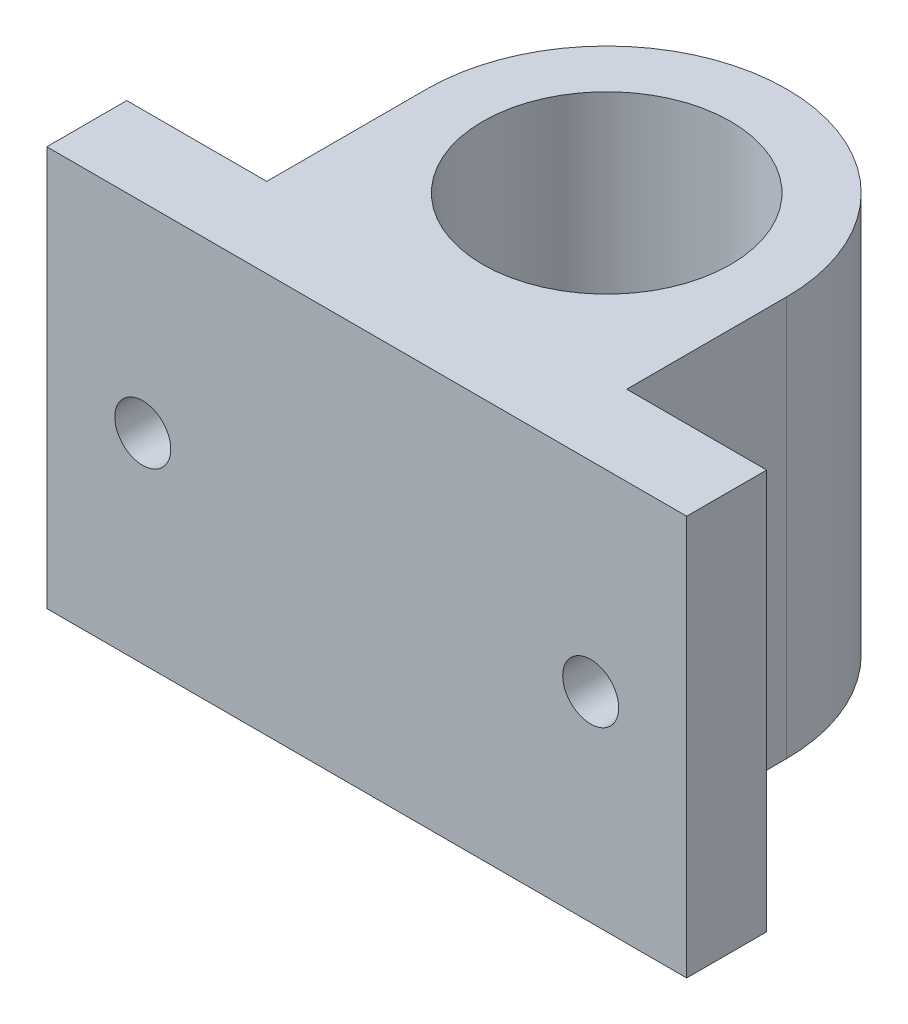
from build123d import *

# Parameters (mm, degrees)
SKETCH_1_R          = 7.75
EXTRUDE_1_DEPTH     = 25
SKETCH_2_R          = 1.75
CUT_EXTRUDE_1_DEPTH = 53.781587215


with BuildPart() as part:
    # 草图1 → 凸台-拉伸1 (new body)
    with BuildSketch(Plane(origin=(0, 0, 0), x_dir=(1, 0, 0), z_dir=(0, 1, 0))):
        with BuildLine():
            Line((1.344086022, 1.112903226), (10.094086022, 1.112903226))
            Line((10.094086022, 1.112903226), (10.094086022, 11.112903226))
            ThreePointArc((10.094086022, 11.112903226), (21.344086022, 22.362903226), (32.594086022, 11.112903226))
            Line((32.594086022, 11.112903226), (32.594086022, 1.112903226))
            Line((32.594086022, 1.112903226), (41.344086022, 1.112903226))
            Line((41.344086022, 1.112903226), (41.344086022, -3.887096774))
            Line((41.344086022, -3.887096774), (1.344086022, -3.887096774))
            Line((1.344086022, -3.887096774), (1.344086022, 1.112903226))
        make_face()
        with Locations(Location((21.344086022, 11.112903226, 0), (0, 0, 270))):
            Circle(SKETCH_1_R, mode=Mode.SUBTRACT)
    extrude(amount=EXTRUDE_1_DEPTH)

    # 草图2 → 切除-拉伸1 (cut, through all)
    with BuildSketch(Plane(origin=(0, 0, -1.112903226), x_dir=(-1, 0, 0), z_dir=(0, 0, -1))):
        with Locations((-35.344086022, 12.5)):
            Circle(SKETCH_2_R)
        with Locations((-7.344086022, 12.5)):
            Circle(SKETCH_2_R)
    extrude(amount=-CUT_EXTRUDE_1_DEPTH, mode=Mode.SUBTRACT)


solid = part.part
